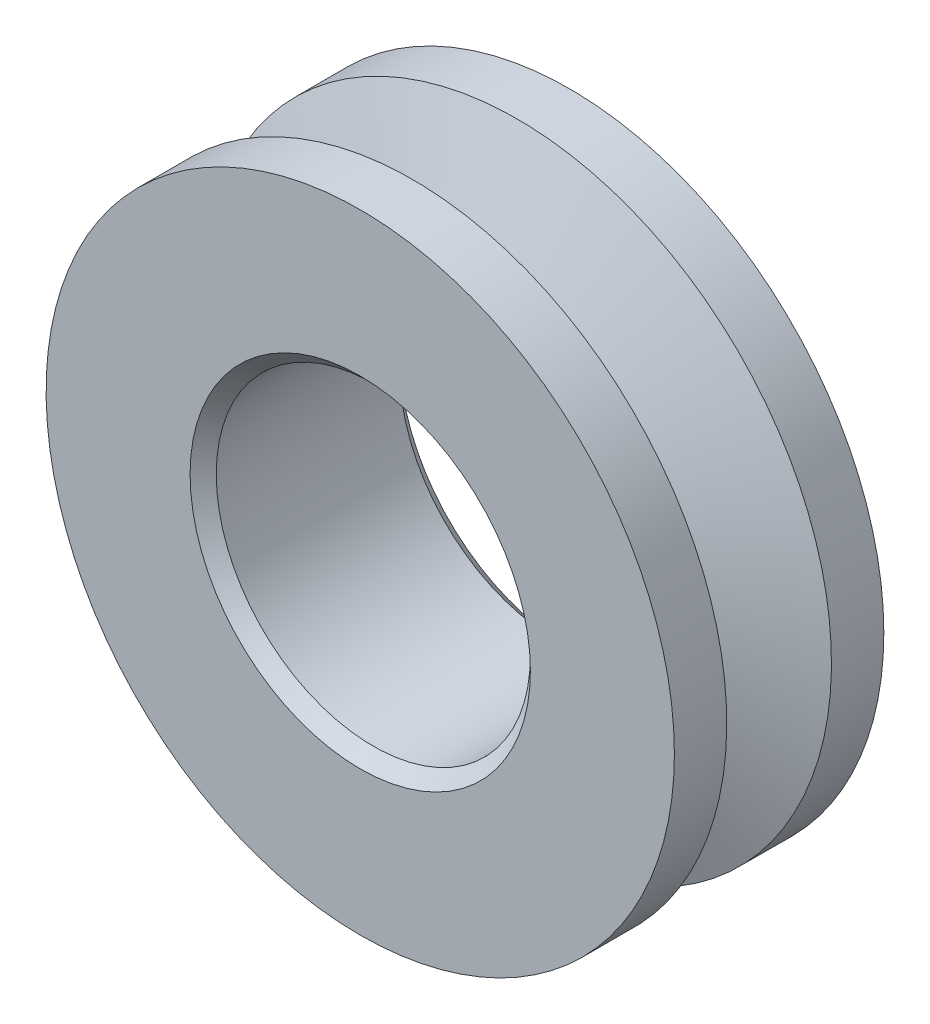
from build123d import *

# Parameters (mm, degrees)
SKETCH1_R      = 19.05
SKETCH1_R_2    = 9.525
EXTRUDE1_DEPTH = 6.35
CHAMFER1_SIZE  = 0.79375


with BuildPart() as part:
    # Sketch1 → Extrude1 (new, symmetric)
    with BuildSketch(Plane.XY):
        Circle(SKETCH1_R)
        Circle(SKETCH1_R_2, mode=Mode.SUBTRACT)
    extrude(amount=EXTRUDE1_DEPTH, both=True)

    # Chamfer1
    chamfer1_edges = [part.edges().sort_by_distance(p)[0] for p in [
        (-9.525, 0, -6.35),
        (-9.525, 0, 6.35),
    ]]
    chamfer(chamfer1_edges, length=CHAMFER1_SIZE)

    # Sketch2 → Cut-Revolve1 (revolve, cut)
    with BuildSketch(Plane(origin=(0, 0, 0), x_dir=(0, 0, -1), z_dir=(1, 0, 0)), mode=Mode.PRIVATE) as cut_revolve1_sk:
        Polygon((-3.175, 19.05), (3.175, 19.05), (0.863789012, 12.7), (-0.863789012, 12.7), align=None)
    revolve(cut_revolve1_sk.sketch.rotate(Axis((0, 0, 6.35), (0, 0, -1)), 180), axis=Axis((0, 0, 6.35), (0, 0, -1)), mode=Mode.SUBTRACT)


solid = part.part
